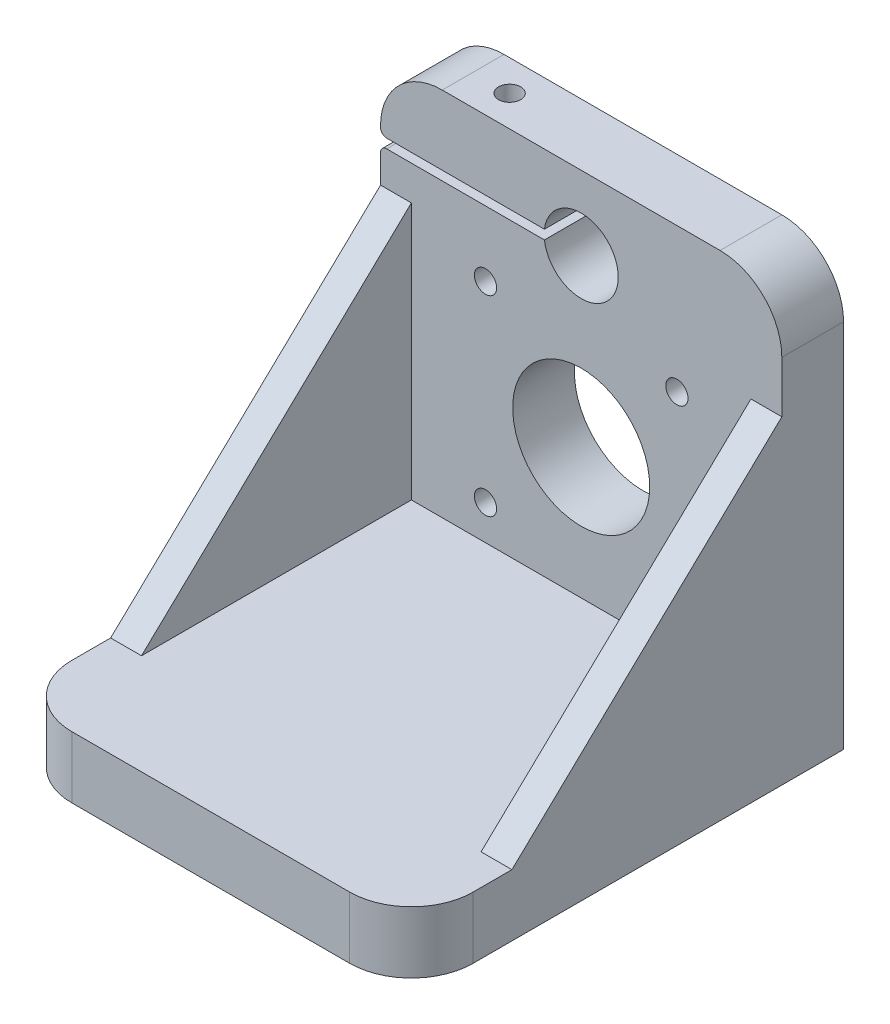
from build123d import *

# Parameters (mm, degrees)
SKETCH1_W           = 65
SKETCH1_H           = 70
BOSS_EXTRUDE1_DEPTH = 10
SKETCH2_W           = 65
SKETCH2_H           = 10
BOSS_EXTRUDE2_DEPTH = 60
FILLET1_R           = 10
CUT_EXTRUDE3_DEPTH  = 60
FILLET2_R           = 10
FILLET3_R           = 1
FILLET4_R           = 1
SKETCH4_R           = 11.1
CUT_EXTRUDE4_DEPTH  = 60
RIB1_REACH          = 103.735
SKETCH5_WALL_W      = 265.86260353
SKETCH5_WALL_H      = 5
SKETCH6_R           = 1.8
CUT_EXTRUDE5_DEPTH  = 20
SKETCH7_R           = 1.8
CUT_EXTRUDE8_DEPTH  = 10
SKETCH9_R           = 3
CUT_EXTRUDE9_DEPTH  = 5


with BuildPart() as part:
    # Sketch1 → Boss-Extrude1 (new body)
    with BuildSketch(Plane(origin=(0, 0, 0), x_dir=(1, 0, 0), z_dir=(0, 1, 0))):
        Rectangle(SKETCH1_W, SKETCH1_H)
    extrude(amount=BOSS_EXTRUDE1_DEPTH)

    # Sketch2 → Boss-Extrude2 (add)
    with BuildSketch(Plane(origin=(0, 10, 0), x_dir=(1, 0, 0), z_dir=(0, 1, 0))):
        with Locations((0, 30)):
            Rectangle(SKETCH2_W, SKETCH2_H)
    extrude(amount=BOSS_EXTRUDE2_DEPTH)

    # Fillet1
    fillet1_edges = [part.edges().sort_by_distance(p)[0] for p in [
        (-32.5, 5, 35),
        (32.5, 5, 35),
    ]]
    fillet(fillet1_edges, radius=FILLET1_R)

    # Sketch3 → Cut-Extrude3 (cut)
    with BuildSketch(Plane.XY.offset(-25)):
        with BuildLine():
            Line((-5.95294045, 58.75), (-32.5, 58.75))
            Line((-32.5, 58.75), (-32.5, 57.25))
            Line((-32.5, 57.25), (-5.95294045, 57.25))
            ThreePointArc((-5.95294045, 57.25), (6, 58), (-5.95294045, 58.75))
        make_face()
    extrude(amount=-CUT_EXTRUDE3_DEPTH, mode=Mode.SUBTRACT)

    # Fillet2
    fillet2_edges = [part.edges().sort_by_distance(p)[0] for p in [
        (-32.5, 70, -30),
        (32.5, 70, -30),
    ]]
    fillet(fillet2_edges, radius=FILLET2_R)

    # Fillet3
    fillet3_edges = [part.edges().sort_by_distance(p)[0] for p in [
        (-32.5, 58.75, -30),
    ]]
    fillet(fillet3_edges, radius=FILLET3_R)

    # Fillet4
    fillet4_edges = [part.edges().sort_by_distance(p)[0] for p in [
        (-32.5, 57.25, -30),
    ]]
    fillet(fillet4_edges, radius=FILLET4_R)

    # Sketch4 → Cut-Extrude4 (cut)
    with BuildSketch(Plane.XY.offset(-25)):
        with Locations((0, 31.15)):
            Circle(SKETCH4_R)
    extrude(amount=-CUT_EXTRUDE4_DEPTH, mode=Mode.SUBTRACT)

    # Sketch5 wall → Rib1 (add, up to next)
    with BuildSketch(Plane(origin=(-32.5, 30.832944907, -3.141178401), x_dir=(0, -0.689915950612, 0.723889481269), z_dir=(0, 0.723889481269, 0.689915950612)), mode=Mode.PRIVATE) as rib1_sk1:
        with Locations((0, 2.5)):
            Rectangle(SKETCH5_WALL_W, SKETCH5_WALL_H)
    rib1_tool1 = extrude(rib1_sk1.sketch, amount=-RIB1_REACH, mode=Mode.PRIVATE) - part.part
    rib1 = rib1_tool1.solids().sort_by_distance((-32.5, 30.832944907, -3.141178401))[0]
    add(rib1)

    # Mirror1: Rib1 across plane
    add(rib1.mirror(Plane(origin=(0, 0, 0), x_dir=(0, 0, 1), z_dir=(1, 0, 0))))

    # Sketch6 → Cut-Extrude5 (cut)
    with BuildSketch(Plane(origin=(0, 70, 0), x_dir=(1, 0, 0), z_dir=(0, 1, 0))):
        with Locations(Location((-16.597294225, 30, 0), (0, 0, 270))):
            Circle(SKETCH6_R)
    extrude(amount=-CUT_EXTRUDE5_DEPTH, mode=Mode.SUBTRACT)

    # Sketch7 → Cut-Extrude8 (cut)
    with BuildSketch(Plane.XY.offset(-25)):
        with Locations((-15.5, 46.65)):
            Circle(SKETCH7_R)
        with Locations((15.5, 46.65)):
            Circle(SKETCH7_R)
        with Locations((15.5, 15.65)):
            Circle(SKETCH7_R)
        with Locations((-15.5, 15.65)):
            Circle(SKETCH7_R)
    extrude(amount=-CUT_EXTRUDE8_DEPTH, mode=Mode.SUBTRACT)

    # Sketch9 → Cut-Extrude9 (cut)
    with BuildSketch(Plane(origin=(0, 0, -35), x_dir=(-1, 0, 0), z_dir=(0, 0, -1))):
        with Locations((-15.5, 46.65)):
            Circle(SKETCH9_R)
        with Locations((15.5, 46.65)):
            Circle(SKETCH9_R)
        with Locations((15.5, 15.65)):
            Circle(SKETCH9_R)
        with Locations((-15.5, 15.65)):
            Circle(SKETCH9_R)
    extrude(amount=-CUT_EXTRUDE9_DEPTH, mode=Mode.SUBTRACT)


solid = part.part
